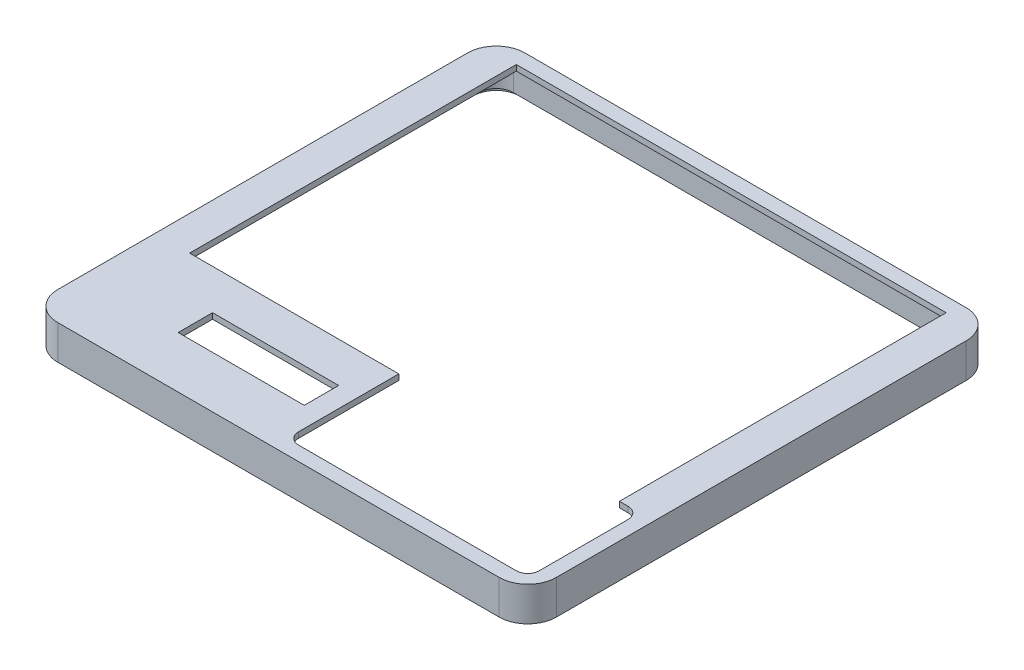
from build123d import *

# Parameters (mm, degrees)
EXTRUDE_4_DEPTH          = 1
EXTRUDE_START            = -5
EXTRUDE_5_DEPTH          = 5
CUT_EXTRUDE_START        = 5
CUT_EXTRUDE_1_DEPTH      = 1
CUT_EXTRUDE_2_DEPTH      = 116.376685757
CUT_EXTRUDE_2_DEPTH_BACK = 116.376685757
SKETCH_8_W               = 22
SKETCH_8_H               = 6
SKETCH_8_W_2             = 75
SKETCH_8_H_2             = 57
CUT_EXTRUDE_3_REACH      = 118.919
SKETCH_9_W               = 10
SKETCH_9_H               = 3


with BuildPart() as part:
    # Эскиз1 → Бобышка-Вытянуть4 (new body)
    with BuildSketch(Plane(origin=(0, 0, 0), x_dir=(1, 0, 0), z_dir=(0, 1, 0))):
        with BuildLine():
            Line((-2.084374602, -1.449446306), (-2.084374602, -72.949446306))
            ThreePointArc((-2.084374602, -72.949446306), (-0.619908508, -76.484980212), (2.915625398, -77.949446306))
            Line((2.915625398, -77.949446306), (79.915625398, -77.949446306))
            ThreePointArc((79.915625398, -77.949446306), (83.451159304, -76.484980212), (84.915625398, -72.949446306))
            Line((84.915625398, -72.949446306), (84.915625398, -1.449446306))
            ThreePointArc((84.915625398, -1.449446306), (83.451159304, 2.0860876), (79.915625398, 3.550553694))
            Line((79.915625398, 3.550553694), (2.915625398, 3.550553694))
            ThreePointArc((2.915625398, 3.550553694), (-0.619908508, 2.0860876), (-2.084374602, -1.449446306))
        make_face()
    extrude(amount=EXTRUDE_4_DEPTH)

    # Эскиз1<14> → Бобышка-Вытянуть5 (add)
    with BuildSketch(Plane(origin=(0, 0, 0), x_dir=(1, 0, 0), z_dir=(0, 1, 0)).offset(EXTRUDE_START)):
        with BuildLine():
            Line((2.915625398, 3.550553694), (79.915625398, 3.550553694))
            ThreePointArc((79.915625398, 3.550553694), (83.451159304, 2.0860876), (84.915625398, -1.449446306))
            Line((84.915625398, -1.449446306), (84.915625398, -72.949446306))
            ThreePointArc((84.915625398, -72.949446306), (83.451159304, -76.484980212), (79.915625398, -77.949446306))
            Line((79.915625398, -77.949446306), (2.915625398, -77.949446306))
            ThreePointArc((2.915625398, -77.949446306), (-0.619908508, -76.484980212), (-2.084374602, -72.949446306))
            Line((-2.084374602, -72.949446306), (-2.084374602, -1.449446306))
            ThreePointArc((-2.084374602, -1.449446306), (-0.619908508, 2.0860876), (2.915625398, 3.550553694))
        make_face()
        with BuildLine():
            ThreePointArc((2.915625398, 1.550553694), (0.794305055, 0.671874038), (-0.084374602, -1.449446306))
            Line((-0.084374602, -1.449446306), (-0.084374602, -72.949446306))
            ThreePointArc((-0.084374602, -72.949446306), (0.794305055, -75.070766649), (2.915625398, -75.949446306))
            Line((2.915625398, -75.949446306), (79.915625398, -75.949446306))
            ThreePointArc((79.915625398, -75.949446306), (82.036945742, -75.070766649), (82.915625398, -72.949446306))
            Line((82.915625398, -72.949446306), (82.915625398, -1.449446306))
            ThreePointArc((82.915625398, -1.449446306), (82.036945742, 0.671874038), (79.915625398, 1.550553694))
            Line((79.915625398, 1.550553694), (2.915625398, 1.550553694))
        make_face(mode=Mode.SUBTRACT)
    extrude(amount=EXTRUDE_5_DEPTH)

    # Эскиз3 → Вырез-Вытянуть1 (cut)
    with BuildSketch(Plane.XZ.offset(CUT_EXTRUDE_START)):
        with BuildLine():
            Line((2.915625398, -2.550553694), (79.915625398, -2.550553694))
            ThreePointArc((79.915625398, -2.550553694), (82.744052523, -1.378980819), (83.915625398, 1.449446306))
            Line((83.915625398, 1.449446306), (83.915625398, 72.949446306))
            ThreePointArc((83.915625398, 72.949446306), (82.744052523, 75.777873431), (79.915625398, 76.949446306))
            Line((79.915625398, 76.949446306), (2.915625398, 76.949446306))
            ThreePointArc((2.915625398, 76.949446306), (0.087198273, 75.777873431), (-1.084374602, 72.949446306))
            Line((-1.084374602, 72.949446306), (-1.084374602, 1.449446306))
            ThreePointArc((-1.084374602, 1.449446306), (0.087198273, -1.378980819), (2.915625398, -2.550553694))
        make_face()
    extrude(amount=-CUT_EXTRUDE_1_DEPTH, mode=Mode.SUBTRACT)

    # Эскиз8 → Вырез-Вытянуть2 (cut, two sides: drawn at the far end of the back side and taken through both)
    with BuildSketch(Plane.XZ.offset(-CUT_EXTRUDE_2_DEPTH_BACK)):
        with BuildLine():
            Line((40.415625398, 55.949446306), (80.415625398, 55.949446306))
            ThreePointArc((80.415625398, 55.949446306), (81.829838961, 56.535232743), (82.415625398, 57.949446306))
            Line((82.415625398, 57.949446306), (82.415625398, 73.449446306))
            ThreePointArc((82.415625398, 73.449446306), (81.829838961, 74.863659868), (80.415625398, 75.449446306))
            Line((80.415625398, 75.449446306), (42.415625398, 75.449446306))
            ThreePointArc((42.415625398, 75.449446306), (41.001411836, 74.863659868), (40.415625398, 73.449446306))
            Line((40.415625398, 73.449446306), (40.415625398, 55.949446306))
        make_face()
        with Locations((25.915625398, 65.949446306)):
            Rectangle(SKETCH_8_W, SKETCH_8_H)
        with Locations((41.415625398, 27.449446306)):
            Rectangle(SKETCH_8_W_2, SKETCH_8_H_2)
    extrude(amount=CUT_EXTRUDE_2_DEPTH + CUT_EXTRUDE_2_DEPTH_BACK, mode=Mode.SUBTRACT)

    # Эскиз9 → Вырез-Вытянуть3 (cut, up to next)
    with BuildSketch(Plane.ZY.offset(2.084374602), mode=Mode.PRIVATE) as cut_extrude_3_sk1:
        with Locations((64.949446306, -3.5)):
            Rectangle(SKETCH_9_W, SKETCH_9_H)
    cut_extrude_3_tool1 = extrude(cut_extrude_3_sk1.sketch, amount=-CUT_EXTRUDE_3_REACH, mode=Mode.PRIVATE) & part.part
    add(cut_extrude_3_tool1.solids().sort_by_distance((-2.084375, -3.5, 64.949446))[0], mode=Mode.SUBTRACT)


solid = part.part
